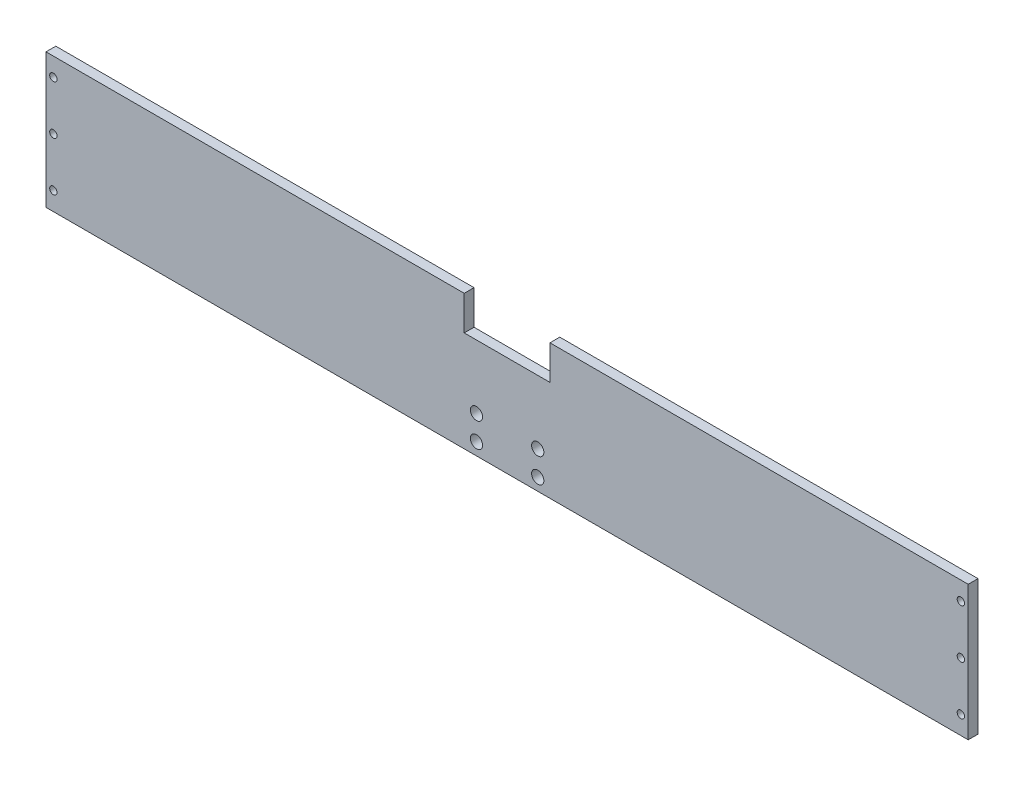
from build123d import *

# Parameters (mm, degrees)
ESQUISSE1_W             = 752.95
ESQUISSE1_H             = 110
BOSS_EXTRU_1_DEPTH      = 8
ENL_V_MAT_EXTRU_1_REACH = 762.985
ESQUISSE2_R             = 5
ENL_V_MAT_EXTRU_2_REACH = 762.985
ESQUISSE3_R             = 3
ENL_V_MAT_EXTRU_3_REACH = 762.985
ESQUISSE4_W             = 70
ESQUISSE4_H             = 28


with BuildPart() as part:
    # Esquisse1 → Boss.-Extru.1 (new body)
    with BuildSketch(Plane.XY):
        with Locations((376.475, 55)):
            Rectangle(ESQUISSE1_W, ESQUISSE1_H)
    extrude(amount=BOSS_EXTRU_1_DEPTH)

    # Esquisse2 → Enlèv. mat.-Extru.1 (cut, up to next)
    with BuildSketch(Plane.XY.offset(8), mode=Mode.PRIVATE) as enl_v_mat_extru_1_sk1:
        with Locations((351.475, 30)):
            Circle(ESQUISSE2_R)
    enl_v_mat_extru_1_tool1 = extrude(enl_v_mat_extru_1_sk1.sketch, amount=-ENL_V_MAT_EXTRU_1_REACH, mode=Mode.PRIVATE) & part.part
    # Esquisse2 → Enlèv. mat.-Extru.1 (cut, up to next)
    with BuildSketch(Plane.XY.offset(8), mode=Mode.PRIVATE) as enl_v_mat_extru_1_sk2:
        with Locations((351.475, 10)):
            Circle(ESQUISSE2_R)
    enl_v_mat_extru_1_tool2 = extrude(enl_v_mat_extru_1_sk2.sketch, amount=-ENL_V_MAT_EXTRU_1_REACH, mode=Mode.PRIVATE) & part.part
    # Esquisse2 → Enlèv. mat.-Extru.1 (cut, up to next)
    with BuildSketch(Plane.XY.offset(8), mode=Mode.PRIVATE) as enl_v_mat_extru_1_sk3:
        with Locations(Location((401.475, 30, 0), (0, 0, 180))):
            Circle(ESQUISSE2_R)
    enl_v_mat_extru_1_tool3 = extrude(enl_v_mat_extru_1_sk3.sketch, amount=-ENL_V_MAT_EXTRU_1_REACH, mode=Mode.PRIVATE) & part.part
    # Esquisse2 → Enlèv. mat.-Extru.1 (cut, up to next)
    with BuildSketch(Plane.XY.offset(8), mode=Mode.PRIVATE) as enl_v_mat_extru_1_sk4:
        with Locations(Location((401.475, 10, 0), (0, 0, 180))):
            Circle(ESQUISSE2_R)
    enl_v_mat_extru_1_tool4 = extrude(enl_v_mat_extru_1_sk4.sketch, amount=-ENL_V_MAT_EXTRU_1_REACH, mode=Mode.PRIVATE) & part.part
    add(enl_v_mat_extru_1_tool1.solids().sort_by_distance((351.475, 30, 8))[0], mode=Mode.SUBTRACT)
    add(enl_v_mat_extru_1_tool2.solids().sort_by_distance((351.475, 10, 8))[0], mode=Mode.SUBTRACT)
    add(enl_v_mat_extru_1_tool3.solids().sort_by_distance((401.475, 30, 8))[0], mode=Mode.SUBTRACT)
    add(enl_v_mat_extru_1_tool4.solids().sort_by_distance((401.475, 10, 8))[0], mode=Mode.SUBTRACT)

    # Esquisse3 → Enlèv. mat.-Extru.2 (cut, up to next)
    with BuildSketch(Plane.XY.offset(8), mode=Mode.PRIVATE) as enl_v_mat_extru_2_sk1:
        with Locations((6, 95)):
            Circle(ESQUISSE3_R)
    enl_v_mat_extru_2_tool1 = extrude(enl_v_mat_extru_2_sk1.sketch, amount=-ENL_V_MAT_EXTRU_2_REACH, mode=Mode.PRIVATE) & part.part
    # Esquisse3 → Enlèv. mat.-Extru.2 (cut, up to next)
    with BuildSketch(Plane.XY.offset(8), mode=Mode.PRIVATE) as enl_v_mat_extru_2_sk2:
        with Locations((6, 55)):
            Circle(ESQUISSE3_R)
    enl_v_mat_extru_2_tool2 = extrude(enl_v_mat_extru_2_sk2.sketch, amount=-ENL_V_MAT_EXTRU_2_REACH, mode=Mode.PRIVATE) & part.part
    # Esquisse3 → Enlèv. mat.-Extru.2 (cut, up to next)
    with BuildSketch(Plane.XY.offset(8), mode=Mode.PRIVATE) as enl_v_mat_extru_2_sk3:
        with Locations((6, 15)):
            Circle(ESQUISSE3_R)
    enl_v_mat_extru_2_tool3 = extrude(enl_v_mat_extru_2_sk3.sketch, amount=-ENL_V_MAT_EXTRU_2_REACH, mode=Mode.PRIVATE) & part.part
    # Esquisse3 → Enlèv. mat.-Extru.2 (cut, up to next)
    with BuildSketch(Plane.XY.offset(8), mode=Mode.PRIVATE) as enl_v_mat_extru_2_sk4:
        with Locations(Location((746.95, 15, 0), (0, 0, 180))):
            Circle(ESQUISSE3_R)
    enl_v_mat_extru_2_tool4 = extrude(enl_v_mat_extru_2_sk4.sketch, amount=-ENL_V_MAT_EXTRU_2_REACH, mode=Mode.PRIVATE) & part.part
    # Esquisse3 → Enlèv. mat.-Extru.2 (cut, up to next)
    with BuildSketch(Plane.XY.offset(8), mode=Mode.PRIVATE) as enl_v_mat_extru_2_sk5:
        with Locations(Location((746.95, 55, 0), (0, 0, 180))):
            Circle(ESQUISSE3_R)
    enl_v_mat_extru_2_tool5 = extrude(enl_v_mat_extru_2_sk5.sketch, amount=-ENL_V_MAT_EXTRU_2_REACH, mode=Mode.PRIVATE) & part.part
    # Esquisse3 → Enlèv. mat.-Extru.2 (cut, up to next)
    with BuildSketch(Plane.XY.offset(8), mode=Mode.PRIVATE) as enl_v_mat_extru_2_sk6:
        with Locations(Location((746.95, 95, 0), (0, 0, 180))):
            Circle(ESQUISSE3_R)
    enl_v_mat_extru_2_tool6 = extrude(enl_v_mat_extru_2_sk6.sketch, amount=-ENL_V_MAT_EXTRU_2_REACH, mode=Mode.PRIVATE) & part.part
    add(enl_v_mat_extru_2_tool1.solids().sort_by_distance((6, 95, 8))[0], mode=Mode.SUBTRACT)
    add(enl_v_mat_extru_2_tool2.solids().sort_by_distance((6, 55, 8))[0], mode=Mode.SUBTRACT)
    add(enl_v_mat_extru_2_tool3.solids().sort_by_distance((6, 15, 8))[0], mode=Mode.SUBTRACT)
    add(enl_v_mat_extru_2_tool4.solids().sort_by_distance((746.95, 15, 8))[0], mode=Mode.SUBTRACT)
    add(enl_v_mat_extru_2_tool5.solids().sort_by_distance((746.95, 55, 8))[0], mode=Mode.SUBTRACT)
    add(enl_v_mat_extru_2_tool6.solids().sort_by_distance((746.95, 95, 8))[0], mode=Mode.SUBTRACT)

    # Esquisse4 → Enlèv. mat.-Extru.3 (cut, up to next)
    with BuildSketch(Plane.XY.offset(8), mode=Mode.PRIVATE) as enl_v_mat_extru_3_sk1:
        with Locations((376.475, 96)):
            Rectangle(ESQUISSE4_W, ESQUISSE4_H)
    enl_v_mat_extru_3_tool1 = extrude(enl_v_mat_extru_3_sk1.sketch, amount=-ENL_V_MAT_EXTRU_3_REACH, mode=Mode.PRIVATE) & part.part
    add(enl_v_mat_extru_3_tool1.solids().sort_by_distance((376.475, 96, 8))[0], mode=Mode.SUBTRACT)


solid = part.part
